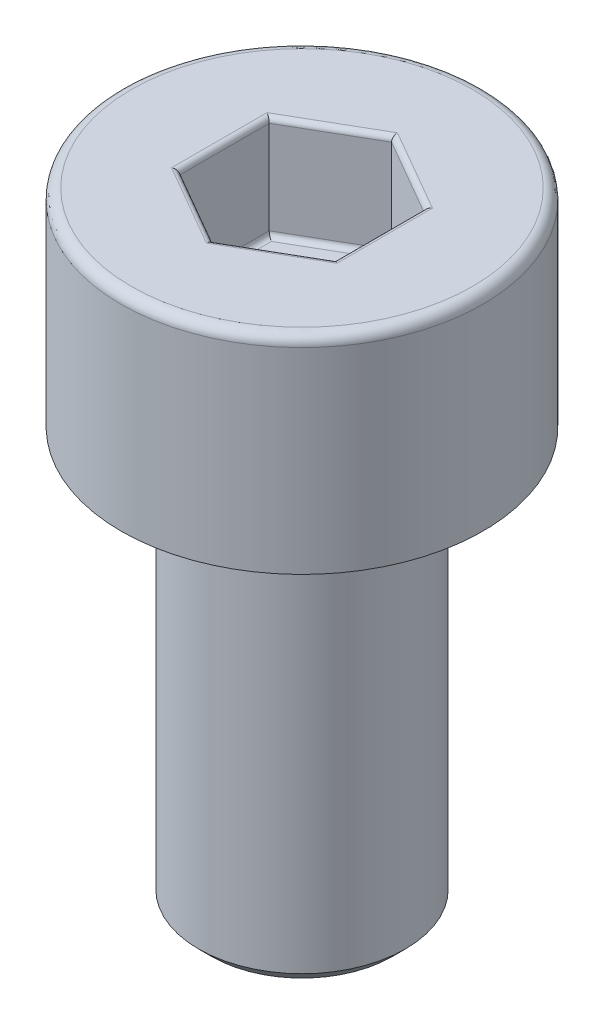
from build123d import *

# Parameters (mm, degrees)
CHAMFER1_SIZE      = 0.25
FILLET1_R          = 0.2
CUT_EXTRUDE1_DEPTH = 2
FILLET2_R          = 0.1


with BuildPart() as part:
    # Sketch1 → Revolve1 (revolve)
    with BuildSketch(Plane.XY, mode=Mode.PRIVATE) as revolve1_sk:
        Polygon((0, -12), (-2, -12), (-2, -4), (-3.5, -4), (-3.5, 0), (0, 0), align=None)
    revolve(revolve1_sk.sketch.rotate(Axis((0, 0, 0), (0, -1, 0)), 270), axis=Axis((0, 0, 0), (0, -1, 0)))

    # Chamfer1
    chamfer1_edges = [part.edges().sort_by_distance(p)[0] for p in [
        (0, -4, -2),
        (0, -12, -2),
    ]]
    chamfer(chamfer1_edges, length=CHAMFER1_SIZE)

    # Fillet1
    fillet1_edges = [part.edges().sort_by_distance(p)[0] for p in [
        (0, 0, -3.5),
    ]]
    fillet(fillet1_edges, radius=FILLET1_R)

    # Sketch2 → Cut-Extrude1 (cut)
    with BuildSketch(Plane(origin=(0, 0, 0), x_dir=(1, 0, 0), z_dir=(0, 1, 0))):
        Polygon((0, 1.732050808), (-1.5, 0.866025404), (-1.5, -0.866025404), (0, -1.732050808), (1.5, -0.866025404), (1.5, 0.866025404), align=None)
    extrude(amount=-CUT_EXTRUDE1_DEPTH, mode=Mode.SUBTRACT)

    # Fillet2
    fillet2_edges = [part.edges().sort_by_distance(p)[0] for p in [
        (0.75, -2, -1.299038106),
        (1.5, -2, 0),
        (0.75, -2, 1.299038106),
        (-0.75, -2, 1.299038106),
        (-1.5, -2, 0),
        (-0.75, -2, -1.299038106),
        (0.75, 0, -1.299038106),
        (-0.75, 0, -1.299038106),
        (-1.5, 0, 0),
        (-0.75, 0, 1.299038106),
        (0.75, 0, 1.299038106),
        (1.5, 0, 0),
    ]]
    fillet(fillet2_edges, radius=FILLET2_R)


solid = part.part
